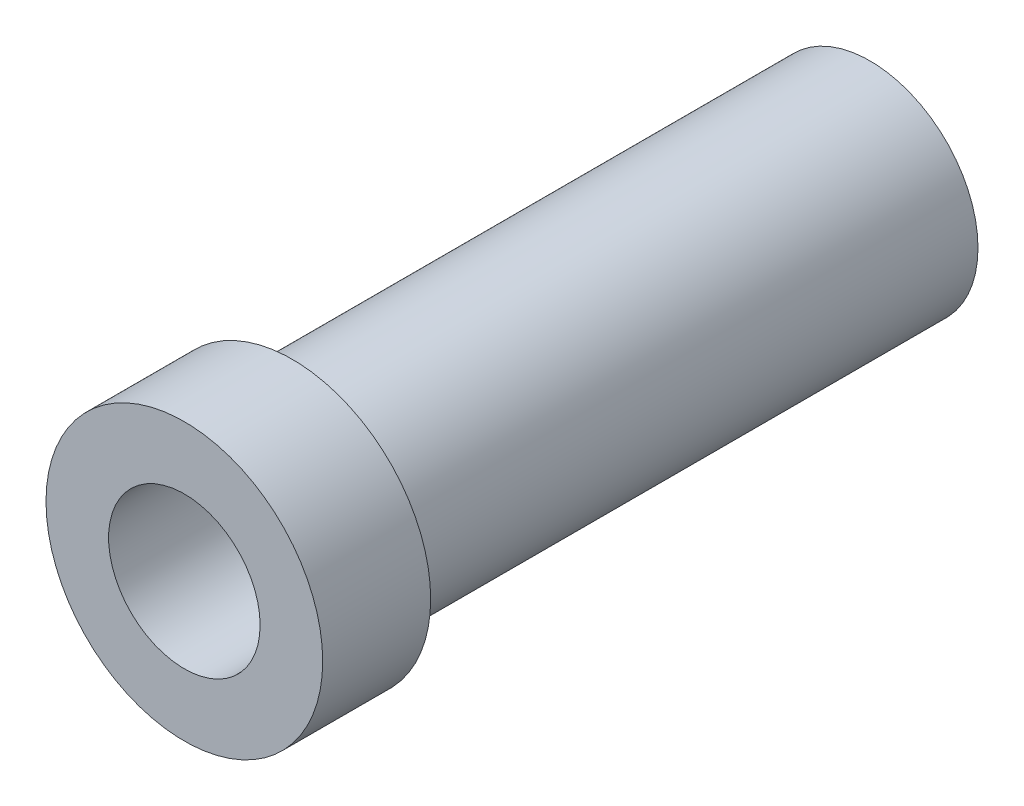
from build123d import *

# Parameters (mm, degrees)
SKETCH1_R              = 4
BOSS_EXTRUDE1_DEPTH    = 12.7
F_10_CLEARANCE_HOLE1_D = 5.6134
BOSS_EXTRUDE2_START    = -4
SKETCH4_R              = 5.125
SKETCH4_R_2            = 2.8067
BOSS_EXTRUDE2_DEPTH    = 4
FILLET1_R              = 0.5


with BuildPart() as part:
    # Sketch1 → Boss-Extrude1 (new, symmetric)
    with BuildSketch(Plane.XY):
        Circle(SKETCH1_R)
    extrude(amount=BOSS_EXTRUDE1_DEPTH, both=True)

    # #10 Clearance Hole1 (through all)
    with Locations(Plane.XY.offset(12.7)):
        with Locations((0, 0)):
            Hole(F_10_CLEARANCE_HOLE1_D / 2)

    # Sketch4 → Boss-Extrude2 (add)
    with BuildSketch(Plane.XY.offset(12.7).offset(BOSS_EXTRUDE2_START)):
        Circle(SKETCH4_R)
        Circle(SKETCH4_R_2, mode=Mode.SUBTRACT)
    extrude(amount=BOSS_EXTRUDE2_DEPTH)

    # Fillet1
    fillet1_edges = [part.edges().sort_by_distance(p)[0] for p in [
        (-4, 0, 8.7),
    ]]
    fillet(fillet1_edges, radius=FILLET1_R)


solid = part.part
